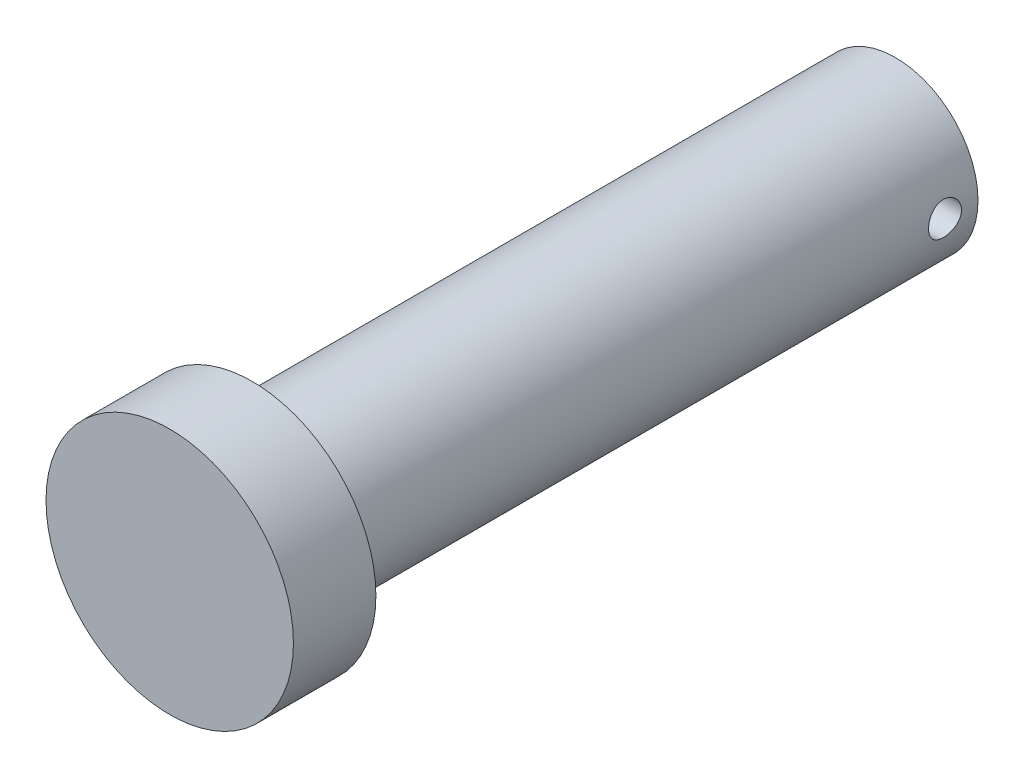
from build123d import *

# Parameters (mm, degrees)
SKETCH1_R               = 5
BOSS_EXTRUDE1_DEPTH     = 44
SKETCH2_R               = 7.5
BOSS_EXTRUDE2_DEPTH     = 5
CUT_EXTRUDE1_DEPTH      = 5
CUT_EXTRUDE1_DEPTH_BACK = 5
SKETCH3_R               = 1


with BuildPart() as part:
    # Sketch1 → Boss-Extrude1 (new body)
    with BuildSketch(Plane.XY):
        Circle(SKETCH1_R)
    extrude(amount=BOSS_EXTRUDE1_DEPTH)

    # Sketch2 → Boss-Extrude2 (add)
    with BuildSketch(Plane.XY.offset(44)):
        Circle(SKETCH2_R)
    extrude(amount=-BOSS_EXTRUDE2_DEPTH)

    # Sketch3 → Cut-Extrude1 (cut, two sides: drawn at the far end of the back side and taken through both)
    with BuildSketch(Plane(origin=(0, 0, 0), x_dir=(0, 0, -1), z_dir=(1, 0, 0)).offset(-CUT_EXTRUDE1_DEPTH_BACK)):
        with Locations(Location((-2, 0, 0), (0, 0, 180))):
            Circle(SKETCH3_R)
    extrude(amount=CUT_EXTRUDE1_DEPTH + CUT_EXTRUDE1_DEPTH_BACK, mode=Mode.SUBTRACT)


solid = part.part
